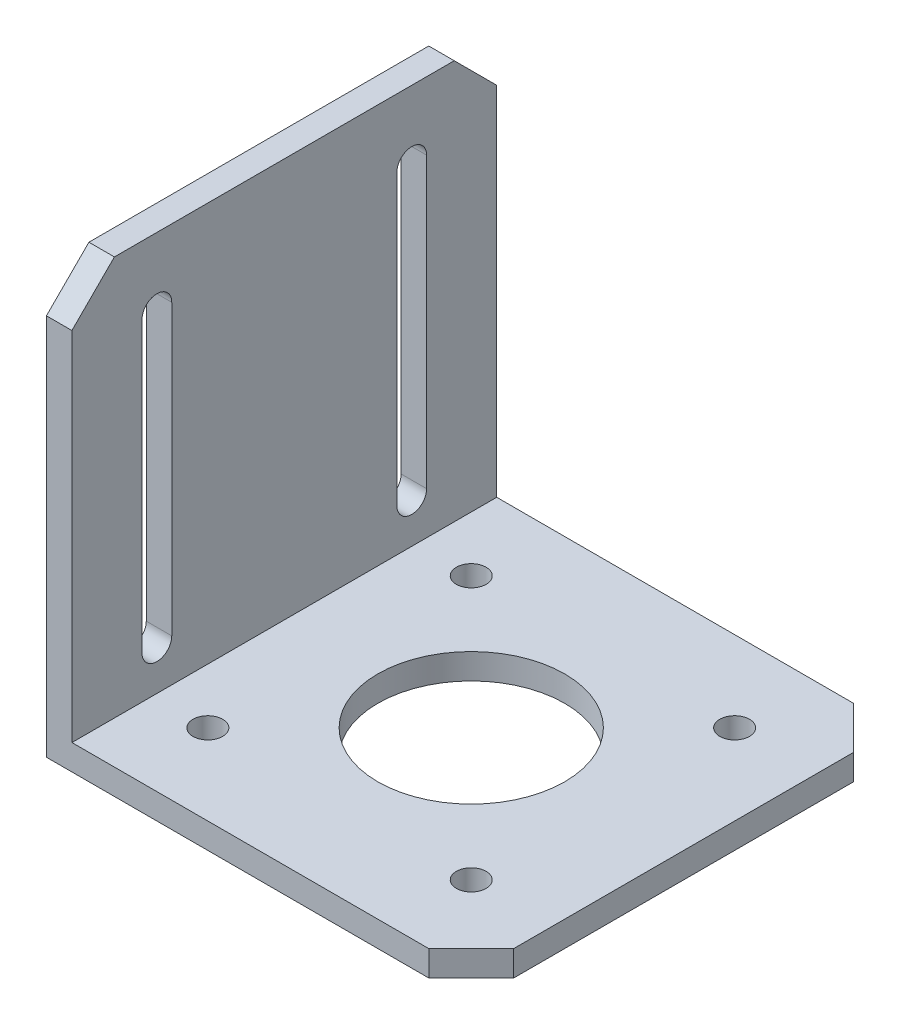
from build123d import *

# Parameters (mm, degrees)
SKETCH1_W           = 50
SKETCH1_H           = 50
SKETCH1_R           = 11
SKETCH1_R_2         = 1.75
BOSS_EXTRUDE1_DEPTH = 3
SKETCH2_W           = 3
SKETCH2_H           = 50
BOSS_EXTRUDE2_DEPTH = 47
CUT_EXTRUDE1_REACH  = 88.603
CHAMFER1_SIZE       = 5
CHAMFER2_SIZE       = 5


with BuildPart() as part:
    # Sketch1 → Boss-Extrude1 (new body)
    with BuildSketch(Plane(origin=(0, 0, 0), x_dir=(1, 0, 0), z_dir=(0, 1, 0))):
        with Locations((25, 25)):
            Rectangle(SKETCH1_W, SKETCH1_H)
        with Locations(Location((25, 25, 0), (0, 0, 270))):
            Circle(SKETCH1_R, mode=Mode.SUBTRACT)
        with Locations(Location((40.5, 40.5, 0), (0, 0, 270))):
            Circle(SKETCH1_R_2, mode=Mode.SUBTRACT)
        with Locations(Location((9.5, 40.5, 0), (0, 0, 270))):
            Circle(SKETCH1_R_2, mode=Mode.SUBTRACT)
        with Locations(Location((9.5, 9.5, 0), (0, 0, 270))):
            Circle(SKETCH1_R_2, mode=Mode.SUBTRACT)
        with Locations(Location((40.5, 9.5, 0), (0, 0, 270))):
            Circle(SKETCH1_R_2, mode=Mode.SUBTRACT)
    extrude(amount=BOSS_EXTRUDE1_DEPTH)

    # Sketch2 → Boss-Extrude2 (add)
    with BuildSketch(Plane(origin=(0, 3, 0), x_dir=(1, 0, 0), z_dir=(0, 1, 0))):
        with Locations((1.5, 25)):
            Rectangle(SKETCH2_W, SKETCH2_H)
    extrude(amount=BOSS_EXTRUDE2_DEPTH)

    # Sketch3 → Cut-Extrude1 (cut, up to next)
    with BuildSketch(Plane.ZY, mode=Mode.PRIVATE) as cut_extrude1_sk1:
        with BuildLine():
            Line((-38.25, 42), (-38.25, 8))
            ThreePointArc((-38.25, 8), (-40, 6.25), (-41.75, 8))
            Line((-41.75, 8), (-41.75, 42))
            ThreePointArc((-41.75, 42), (-40, 43.75), (-38.25, 42))
        make_face()
    cut_extrude1_tool1 = extrude(cut_extrude1_sk1.sketch, amount=-CUT_EXTRUDE1_REACH, mode=Mode.PRIVATE) & part.part
    # Sketch3 → Cut-Extrude1 (cut, up to next)
    with BuildSketch(Plane.ZY, mode=Mode.PRIVATE) as cut_extrude1_sk2:
        with BuildLine():
            Line((-11.75, 42), (-11.75, 8))
            ThreePointArc((-11.75, 8), (-10, 6.25), (-8.25, 8))
            Line((-8.25, 8), (-8.25, 42))
            ThreePointArc((-8.25, 42), (-10, 43.75), (-11.75, 42))
        make_face()
    cut_extrude1_tool2 = extrude(cut_extrude1_sk2.sketch, amount=-CUT_EXTRUDE1_REACH, mode=Mode.PRIVATE) & part.part
    add(cut_extrude1_tool1.solids().sort_by_distance((0, 25, -40))[0], mode=Mode.SUBTRACT)
    add(cut_extrude1_tool2.solids().sort_by_distance((0, 25, -10))[0], mode=Mode.SUBTRACT)

    # Chamfer1
    chamfer1_edges = [part.edges().sort_by_distance(p)[0] for p in [
        (1.5, 50, 0),
        (1.5, 50, -50),
    ]]
    chamfer(chamfer1_edges, length=CHAMFER1_SIZE)

    # Chamfer2
    chamfer2_edges = [part.edges().sort_by_distance(p)[0] for p in [
        (50, 1.5, -50),
        (50, 1.5, 0),
    ]]
    chamfer(chamfer2_edges, length=CHAMFER2_SIZE)


solid = part.part
